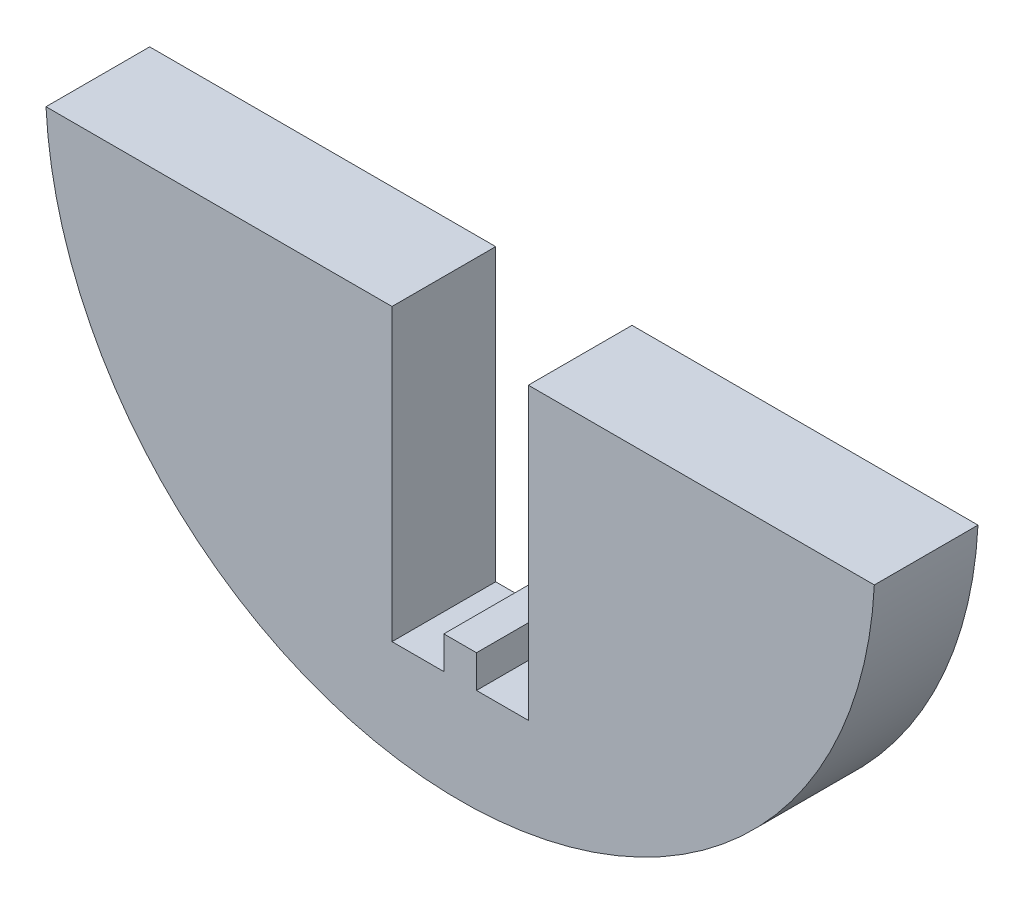
from build123d import *

# Parameters (mm, degrees)
BOSS_EXTRUDE2_DEPTH = 6.35


with BuildPart() as part:
    # 3DSketch1 → Boss-Extrude2 (new body)
    with BuildSketch(Plane(origin=(4.175, -19.05, 0), x_dir=(-0.8568004384031221, 0.5156481443312075, 0), z_dir=(0, 0, -1))):
        with BuildLine():
            Line((0, 0), (9.168224006, 15.233911795))
            Line((9.168224006, 15.233911795), (-8.990144862, 26.162161584))
            ThreePointArc((-8.990144862, 26.162161584), (0.302776114, -7.593513786), (34.480876535, 0))
            Line((34.480876535, 0), (16.322507667, 10.92824979))
            Line((16.322507667, 10.92824979), (7.154283661, -4.305662005))
            Line((7.154283661, -4.305662005), (4.433942269, -2.668479147))
            Line((4.433942269, -2.668479147), (5.465238557, -0.95487827))
            Line((5.465238557, -0.95487827), (3.751637681, 0.076418019))
            Line((3.751637681, 0.076418019), (2.720341392, -1.637182858))
            Line((2.720341392, -1.637182858), (0, 0))
        make_face()
    extrude(amount=-BOSS_EXTRUDE2_DEPTH)


solid = part.part
